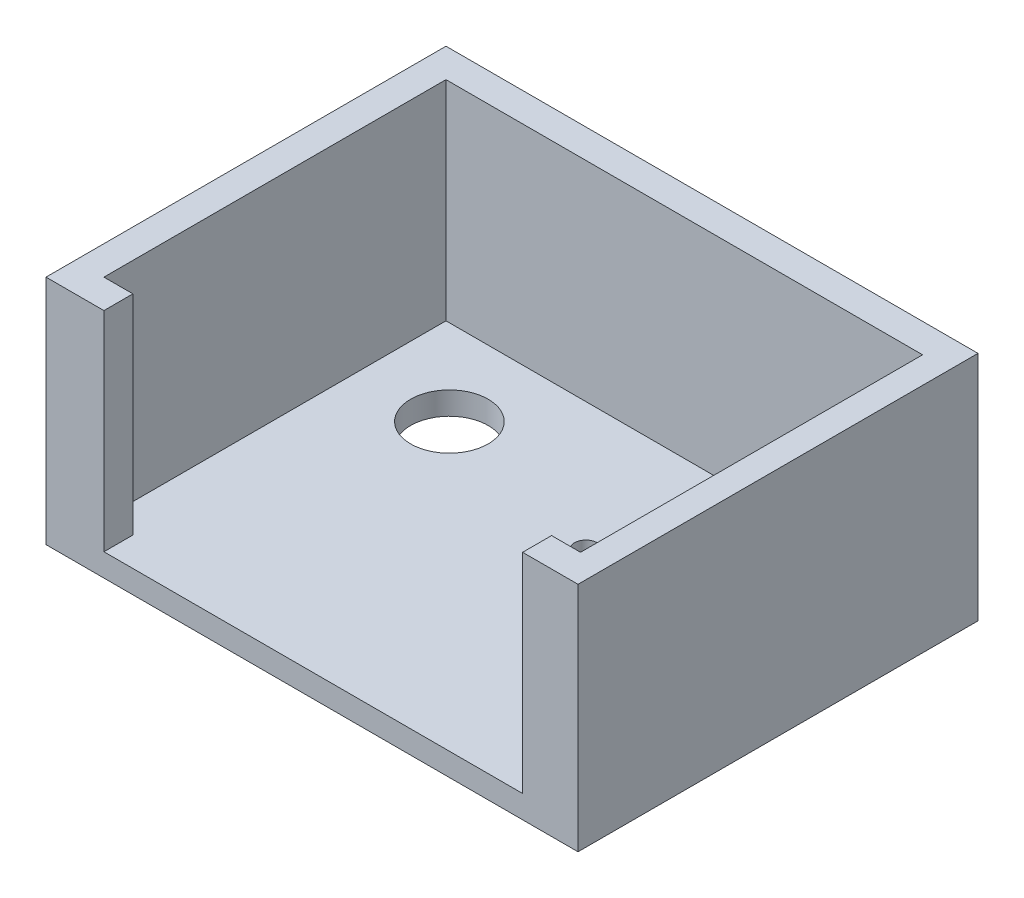
from build123d import *

# Parameters (mm, degrees)
SKETCH1_W           = 23.33
SKETCH1_H           = 17.54
BOSS_EXTRUDE1_DEPTH = 10.16
SKETCH2_W           = 20.9
SKETCH2_H           = 15
CUT_EXTRUDE1_DEPTH  = 9.16
SKETCH3_R           = 1.7
SKETCH3_R_2         = 0.5
CUT_EXTRUDE2_DEPTH  = 31.591601789
SKETCH4_W           = 18.36
SKETCH4_H           = 12.01194936
CUT_EXTRUDE3_DEPTH  = 31.20310249


with BuildPart() as part:
    # Sketch1 → Boss-Extrude1 (new body)
    with BuildSketch(Plane(origin=(0, 0, 0), x_dir=(1, 0, 0), z_dir=(0, 1, 0))):
        with Locations((11.665, 8.77)):
            Rectangle(SKETCH1_W, SKETCH1_H)
    extrude(amount=BOSS_EXTRUDE1_DEPTH)

    # Sketch2 → Cut-Extrude1 (cut)
    with BuildSketch(Plane(origin=(0, 10.16, 0), x_dir=(1, 0, 0), z_dir=(0, 1, 0))):
        with Locations((11.72, 8.77)):
            Rectangle(SKETCH2_W, SKETCH2_H)
    extrude(amount=-CUT_EXTRUDE1_DEPTH, mode=Mode.SUBTRACT)

    # Sketch3 → Cut-Extrude2 (cut, through all)
    with BuildSketch(Plane(origin=(0, 1, 0), x_dir=(1, 0, 0), z_dir=(0, 1, 0))):
        with Locations(Location((5.17, 12.52, 0), (0, 0, 270))):
            Circle(SKETCH3_R)
        with Locations(Location((18.27, 12.52, 0), (0, 0, 270))):
            Circle(SKETCH3_R)
        with Locations(Location((13.015, 10.66, 0), (0, 0, 270))):
            Circle(SKETCH3_R_2)
    extrude(amount=-CUT_EXTRUDE2_DEPTH, mode=Mode.SUBTRACT)

    # Sketch4 → Cut-Extrude3 (cut, through all)
    with BuildSketch(Plane(origin=(0, 0, -1.27), x_dir=(-1, 0, 0), z_dir=(0, 0, -1))):
        with Locations((-11.72, 7.00597468)):
            Rectangle(SKETCH4_W, SKETCH4_H)
    extrude(amount=-CUT_EXTRUDE3_DEPTH, mode=Mode.SUBTRACT)


solid = part.part
